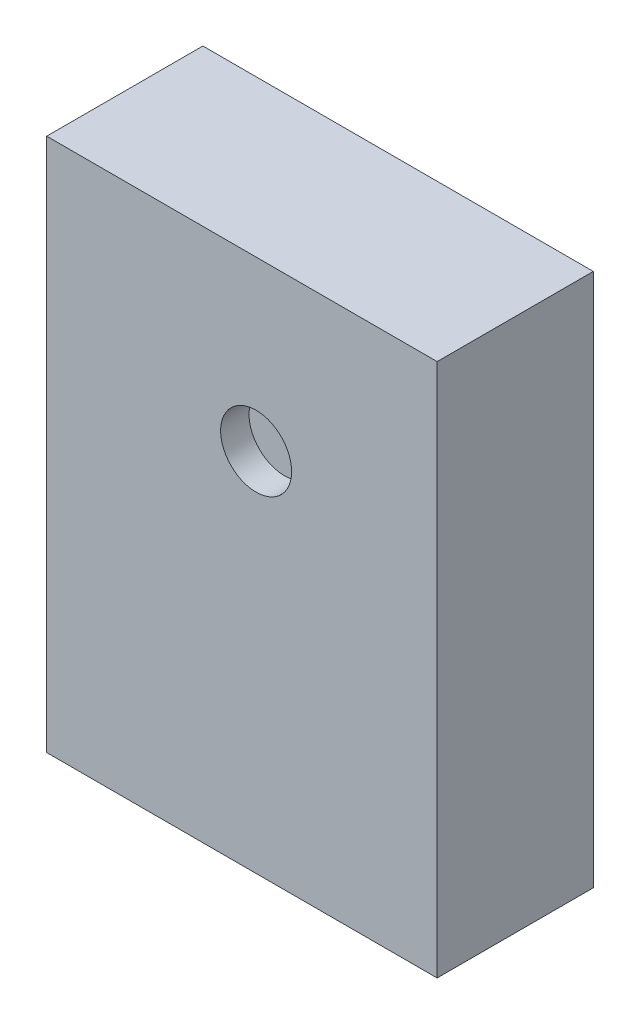
from build123d import *

# Parameters (mm, degrees)
SKETCH1_W           = 2.75
SKETCH1_H           = 3.76
BOSS_EXTRUDE1_DEPTH = 1.1
SKETCH2_R           = 0.25
CUT_EXTRUDE1_DEPTH  = 0.2


with BuildPart() as part:
    # Sketch1 → Boss-Extrude1 (new body)
    with BuildSketch(Plane.XY):
        Rectangle(SKETCH1_W, SKETCH1_H)
    extrude(amount=BOSS_EXTRUDE1_DEPTH)

    # Sketch2 → Cut-Extrude1 (cut)
    with BuildSketch(Plane.XY.offset(1.1)):
        with Locations((0.1, 0.696)):
            Circle(SKETCH2_R)
    extrude(amount=-CUT_EXTRUDE1_DEPTH, mode=Mode.SUBTRACT)


solid = part.part
